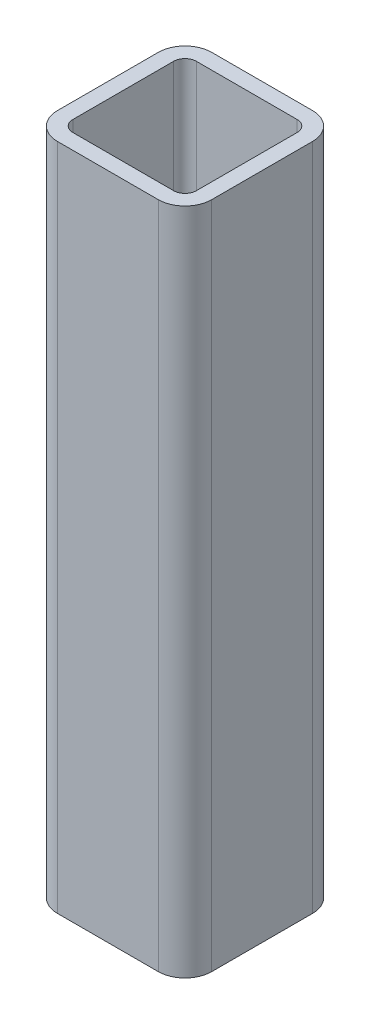
from build123d import *

# Parameters (mm, degrees)
SQUARE_TUBE_30_X_30_X_2_6_1_DEPTH = 130


with BuildPart() as part:
    # Sketch12 → Square tube 30 X 30 X 2.6(1) (new body)
    with BuildSketch(Plane(origin=(0, 0, 0), x_dir=(1, 0, 0), z_dir=(0, 1, 0))):
        with BuildLine():
            Line((-9.8, -15), (9.8, -15))
            ThreePointArc((9.8, -15), (13.476955262, -13.476955262), (15, -9.8))
            Line((15, -9.8), (15, 9.8))
            ThreePointArc((15, 9.8), (13.476955262, 13.476955262), (9.8, 15))
            Line((9.8, 15), (-9.8, 15))
            ThreePointArc((-9.8, 15), (-13.476955262, 13.476955262), (-15, 9.8))
            Line((-15, 9.8), (-15, -9.8))
            ThreePointArc((-15, -9.8), (-13.476955262, -13.476955262), (-9.8, -15))
        make_face()
        with BuildLine():
            Line((-9.8, -12), (9.8, -12))
            ThreePointArc((9.8, -12), (11.355634919, -11.355634919), (12, -9.8))
            Line((12, -9.8), (12, 9.8))
            ThreePointArc((12, 9.8), (11.355634919, 11.355634919), (9.8, 12))
            Line((9.8, 12), (-9.8, 12))
            ThreePointArc((-9.8, 12), (-11.355634919, 11.355634919), (-12, 9.8))
            Line((-12, 9.8), (-12, -9.8))
            ThreePointArc((-12, -9.8), (-11.355634919, -11.355634919), (-9.8, -12))
        make_face(mode=Mode.SUBTRACT)
    extrude(amount=SQUARE_TUBE_30_X_30_X_2_6_1_DEPTH)


solid = part.part
